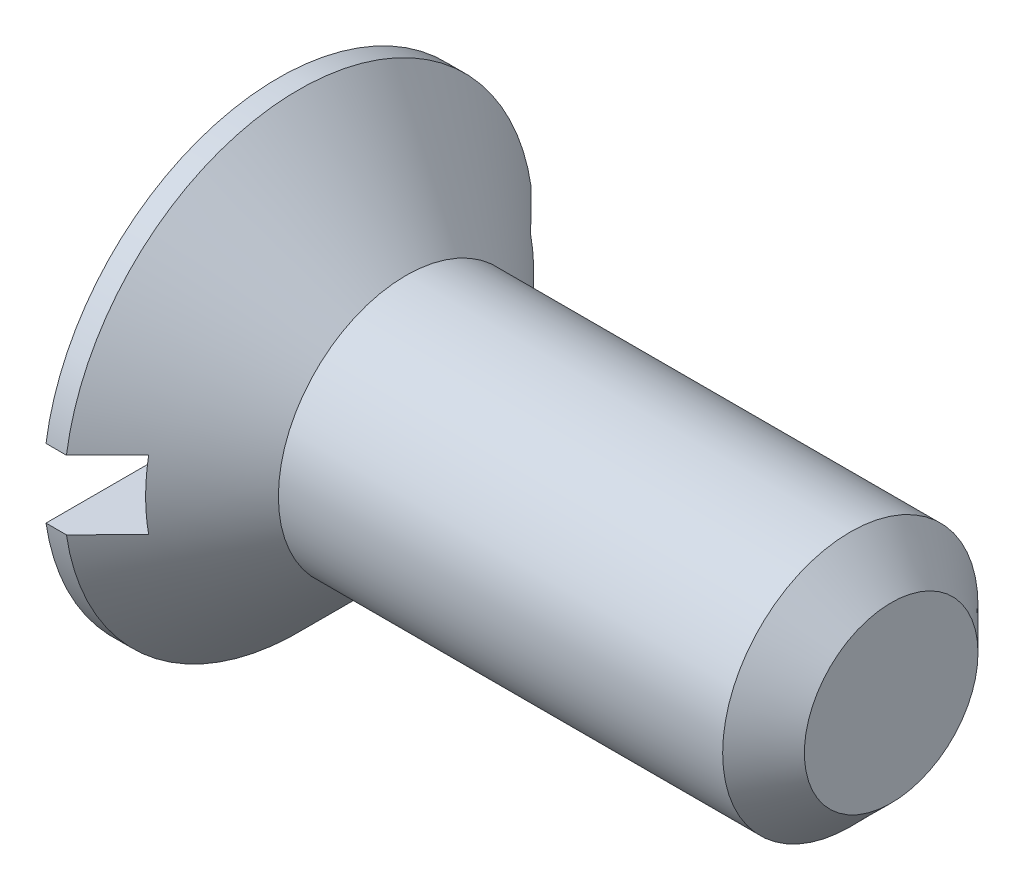
from build123d import *

# Parameters (mm, degrees)
SKETCH_1_R               = 2.5
EXTRUDE_654_DEPTH        = 12
CHAMFER_1_SIZE           = 0.8
CUT_EXTRUDE_1_DEPTH      = 14.649908425
CUT_EXTRUDE_1_DEPTH_BACK = 14.649908425
SKETCH_4_W               = 1.2
SKETCH_4_H               = 1.35


with BuildPart() as part:
    # Эскиз1 → Extrude 654 (new body)
    with BuildSketch(Plane(origin=(0, 0, 0), x_dir=(0, 0, -1), z_dir=(1, 0, 0))):
        Circle(SKETCH_1_R)
    extrude(amount=EXTRUDE_654_DEPTH)

    # Фаска1
    chamfer_1_edges = [part.edges().sort_by_distance(p)[0] for p in [
        (12, 0, 2.5),
    ]]
    chamfer(chamfer_1_edges, length=CHAMFER_1_SIZE)

    # Эскиз2 → Бобышка-Повернуть1 (revolve)
    with BuildSketch(Plane.XY, mode=Mode.PRIVATE) as revolve_1_sk:
        Polygon((0, 4.6), (0.4, 4.6), (2.5, 2.5), (2.5, 0), (0, 0), align=None)
    revolve(revolve_1_sk.sketch.rotate(Axis((0, 0, 0), (1, 0, 0)), 90), axis=Axis((0, 0, 0), (1, 0, 0)))

    # Эскиз4 → Вырез-Вытянуть1 (cut, two sides: drawn at the far end of the back side and taken through both)
    with BuildSketch(Plane.XY.offset(-CUT_EXTRUDE_1_DEPTH_BACK)):
        with Locations((0.6, 0)):
            Rectangle(SKETCH_4_W, SKETCH_4_H)
    extrude(amount=CUT_EXTRUDE_1_DEPTH + CUT_EXTRUDE_1_DEPTH_BACK, mode=Mode.SUBTRACT)


solid = part.part
